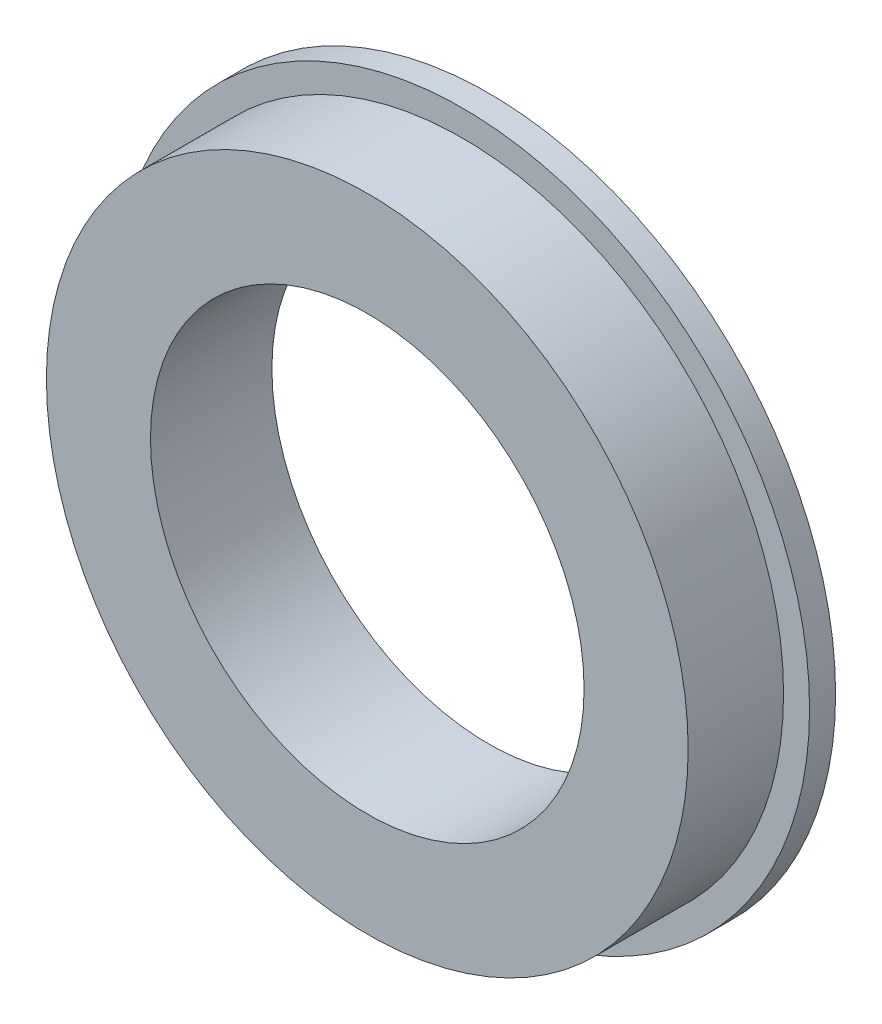
from build123d import *

# Parameters (mm, degrees)
SKETCH1_R      = 20
SKETCH1_R_2    = 12.5
EXTRUDE1_DEPTH = 1.5
SKETCH2_R      = 18.5
SKETCH2_R_2    = 12.5
EXTRUDE2_DEPTH = 5.5


with BuildPart() as part:
    # Sketch1 → Extrude1 (new body)
    with BuildSketch(Plane.XY):
        Circle(SKETCH1_R)
        Circle(SKETCH1_R_2, mode=Mode.SUBTRACT)
    extrude(amount=EXTRUDE1_DEPTH)

    # Sketch2 → Extrude2 (add)
    with BuildSketch(Plane.XY.offset(1.5)):
        Circle(SKETCH2_R)
        Circle(SKETCH2_R_2, mode=Mode.SUBTRACT)
    extrude(amount=EXTRUDE2_DEPTH)


solid = part.part
